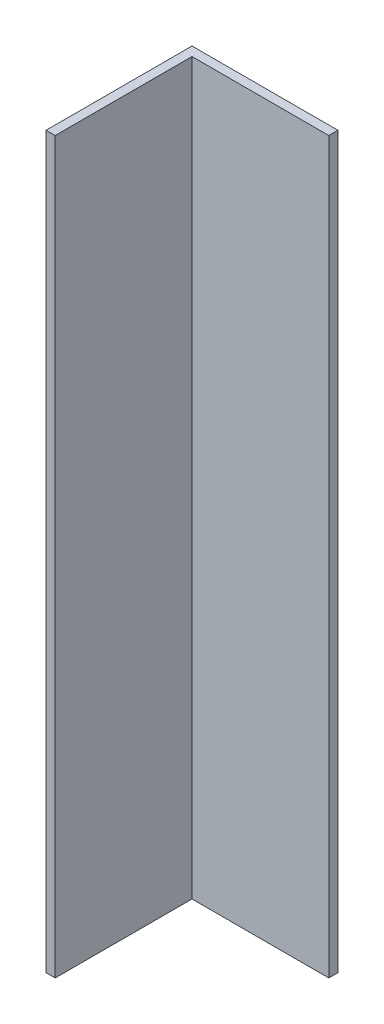
from build123d import *

# Parameters (mm, degrees)
SKETCH1_W           = 25.4
SKETCH1_H           = 25.4
BOSS_EXTRUDE1_DEPTH = 127
SKETCH2_W           = 23.8125
SKETCH2_H           = 23.8125
CUT_EXTRUDE1_DEPTH  = 132.982271537


with BuildPart() as part:
    # Sketch1 → Boss-Extrude1 (new body)
    with BuildSketch(Plane(origin=(0, 0, 0), x_dir=(1, 0, 0), z_dir=(0, 1, 0))):
        with Locations((12.7, -12.7)):
            Rectangle(SKETCH1_W, SKETCH1_H)
    extrude(amount=BOSS_EXTRUDE1_DEPTH)

    # Sketch2 → Cut-Extrude1 (cut, through all)
    with BuildSketch(Plane(origin=(0, 127, 0), x_dir=(1, 0, 0), z_dir=(0, 1, 0))):
        with Locations((13.49375, -13.49375)):
            Rectangle(SKETCH2_W, SKETCH2_H)
    extrude(amount=-CUT_EXTRUDE1_DEPTH, mode=Mode.SUBTRACT)


solid = part.part
